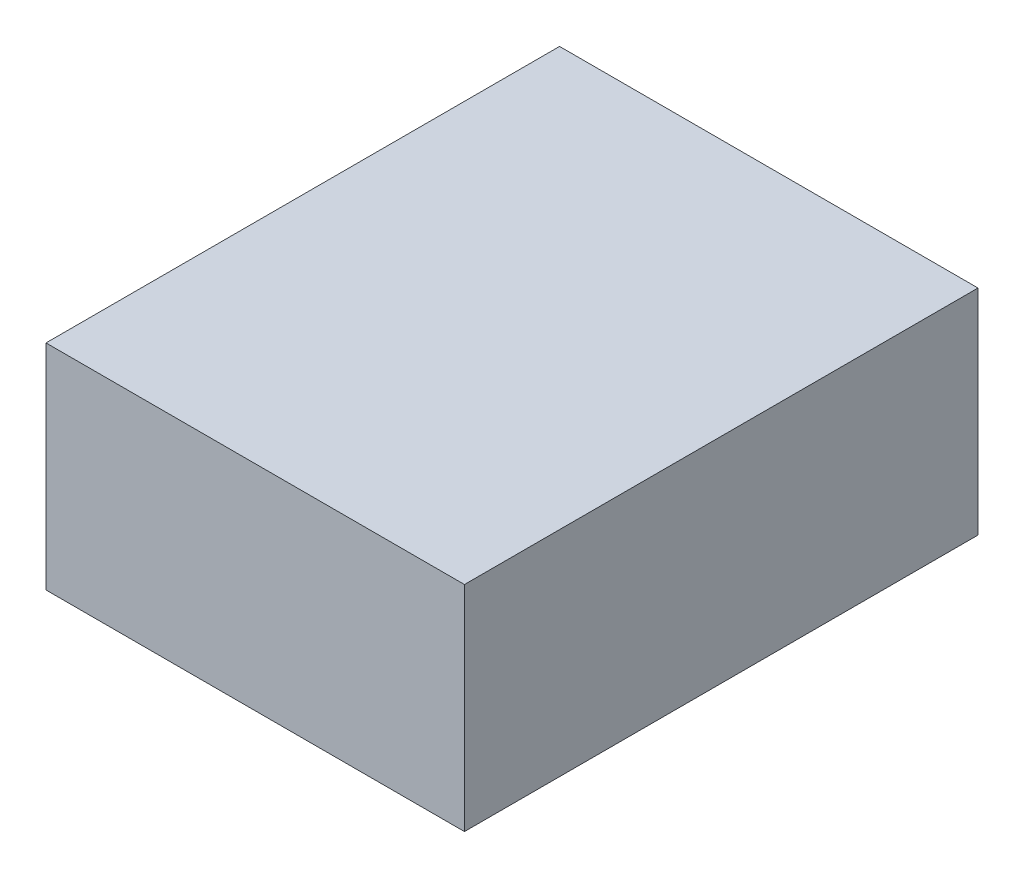
from build123d import *

# Parameters (mm, degrees)
SKETCH1_W           = 432
SKETCH1_H           = 180
BOSS_EXTRUDE1_DEPTH = 352


with BuildPart() as part:
    # Sketch1 → Boss-Extrude1 (new body)
    with BuildSketch(Plane(origin=(0, 0, 0), x_dir=(0, 0, -1), z_dir=(1, 0, 0))):
        Rectangle(SKETCH1_W, SKETCH1_H)
    extrude(amount=BOSS_EXTRUDE1_DEPTH)


solid = part.part
